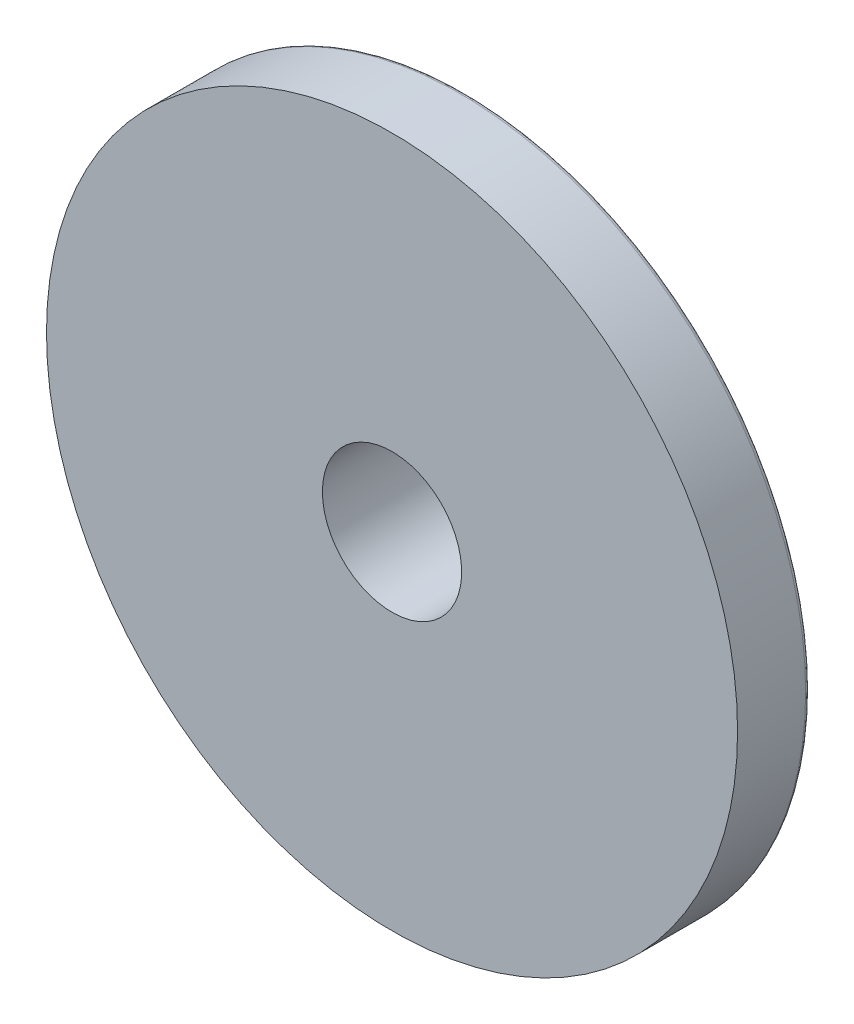
from build123d import *


with BuildPart() as part:
    # Sk_flange_section → Rev_flange (revolve)
    with BuildSketch(Plane(origin=(0, -19.05, 0), x_dir=(1, 0, 0), z_dir=(0, 1, 0)), mode=Mode.PRIVATE) as rev_flange_sk:
        with BuildLine():
            Line((46.228, 7.9375), (76.93025, 7.9375))
            Line((76.93025, 7.9375), (76.93025, 15.50924))
            ThreePointArc((76.93025, 15.50924), (76.834622271, 15.805910462), (76.584339104, 15.991696258))
            ThreePointArc((76.584339104, 15.991696258), (61.859650948, 19.664260346), (46.738726881, 20.953377723))
            ThreePointArc((46.738726881, 20.953377723), (46.377236954, 20.805422618), (46.228, 20.44446))
            Line((46.228, 20.44446), (46.228, 7.9375))
        make_face()
    revolve(rev_flange_sk.sketch.rotate(Axis((38.481, -19.05, -50.8), (0, 0, 1)), 180), axis=Axis((38.481, -19.05, -50.8), (0, 0, 1)))


solid = part.part
